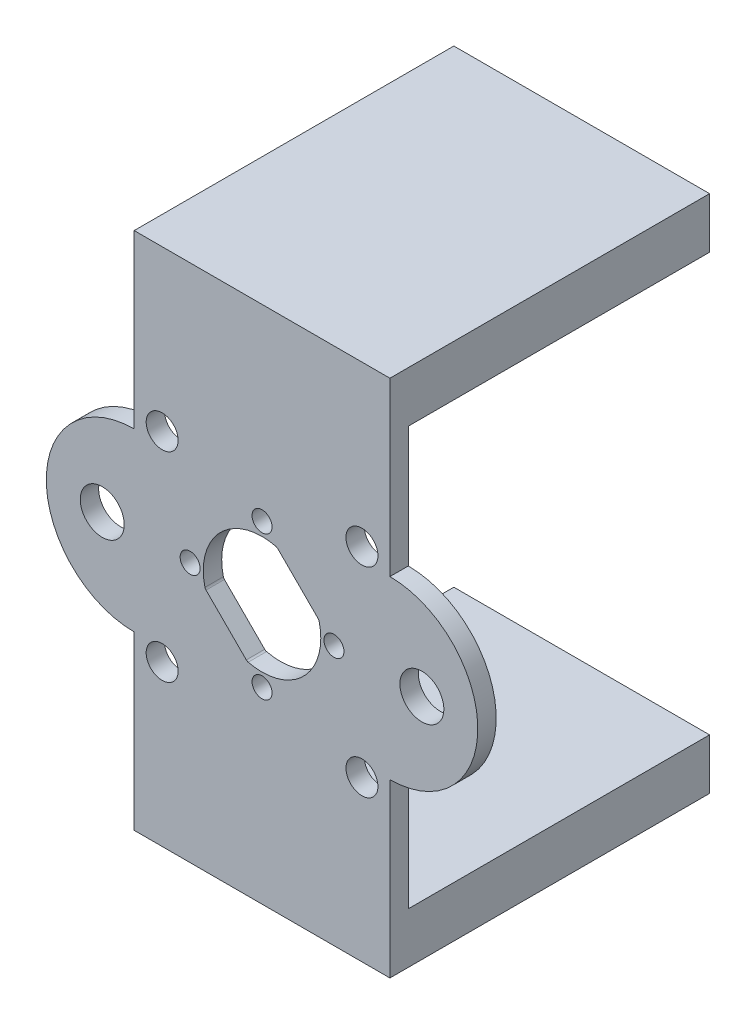
from build123d import *

# Parameters (mm, degrees)
SKETCH1_W           = 32
SKETCH1_H           = 65
BOSS_EXTRUDE1_DEPTH = 40
SKETCH2_W           = 32
SKETCH2_H           = 52.3
CUT_EXTRUDE1_DEPTH  = 37.7
BOSS_EXTRUDE4_DEPTH = 2.3
SKETCH3_7_R         = 1.25
SKETCH3_7_R_2       = 2
SKETCH3_7_R_3       = 2.75
CUT_EXTRUDE3_DEPTH  = 2.3


with BuildPart() as part:
    # Sketch1 → Boss-Extrude1 (new body)
    with BuildSketch(Plane.XY):
        Rectangle(SKETCH1_W, SKETCH1_H)
    extrude(amount=-BOSS_EXTRUDE1_DEPTH)

    # Sketch2 → Cut-Extrude1 (cut)
    with BuildSketch(Plane(origin=(0, 0, -40), x_dir=(-1, 0, 0), z_dir=(0, 0, -1))):
        Rectangle(SKETCH2_W, SKETCH2_H)
    extrude(amount=-CUT_EXTRUDE1_DEPTH, mode=Mode.SUBTRACT)

    # Sketch3 → Boss-Extrude4 (add)
    with BuildSketch(Plane.XY):
        with BuildLine():
            Line((16, -32.5), (-16, -32.5))
            Line((-16, -32.5), (-16, -11))
            ThreePointArc((-16, -11), (-27, 0), (-16, 11))
            Line((-16, 11), (-16, 32.5))
            Line((-16, 32.5), (16, 32.5))
            Line((16, 32.5), (16, 11))
            ThreePointArc((16, 11), (27, 0), (16, -11))
            Line((16, -11), (16, -32.5))
        make_face()
    extrude(amount=-BOSS_EXTRUDE4_DEPTH)

    # Sketch3<7> → Cut-Extrude3 (cut)
    with BuildSketch(Plane.XY):
        with Locations((0, -9.000000134)):
            Circle(SKETCH3_7_R)
        with BuildLine():
            ThreePointArc((-1.734657981, -7.142370873), (5.197234842, -5.197234842), (7.142370873, 1.734657981))
            ThreePointArc((7.142370873, 1.734657981), (7.092420905, 1.861539458), (7.010048694, 1.970207427))
            Line((7.010048694, 1.970207427), (1.970207427, 7.010048694))
            Line((1.970207427, 7.010048694), (1.734657981, 7.142370873))
            ThreePointArc((1.734657981, 7.142370873), (-5.197234842, 5.197234842), (-7.142370873, -1.734657981))
            ThreePointArc((-7.142370873, -1.734657981), (-7.092420905, -1.861539458), (-7.010048694, -1.970207427))
            Line((-7.010048694, -1.970207427), (-1.970207427, -7.010048694))
            ThreePointArc((-1.970207427, -7.010048694), (-1.861539458, -7.092420905), (-1.734657981, -7.142370873))
        make_face()
        with Locations((0, 9.000000134)):
            Circle(SKETCH3_7_R)
        with Locations((12.5, -12.5)):
            Circle(SKETCH3_7_R_2)
        with Locations((-12.5, -12.5)):
            Circle(SKETCH3_7_R_2)
        with Locations((-12.5, 12.5)):
            Circle(SKETCH3_7_R_2)
        with Locations((12.5, 12.5)):
            Circle(SKETCH3_7_R_2)
        with Locations((9.000000134, 0)):
            Circle(SKETCH3_7_R)
        with Locations((-9.000000134, 0)):
            Circle(SKETCH3_7_R)
        with Locations((-20, 0)):
            Circle(SKETCH3_7_R_3)
        with Locations((20, 0)):
            Circle(SKETCH3_7_R_3)
    extrude(amount=-CUT_EXTRUDE3_DEPTH, mode=Mode.SUBTRACT)


solid = part.part
